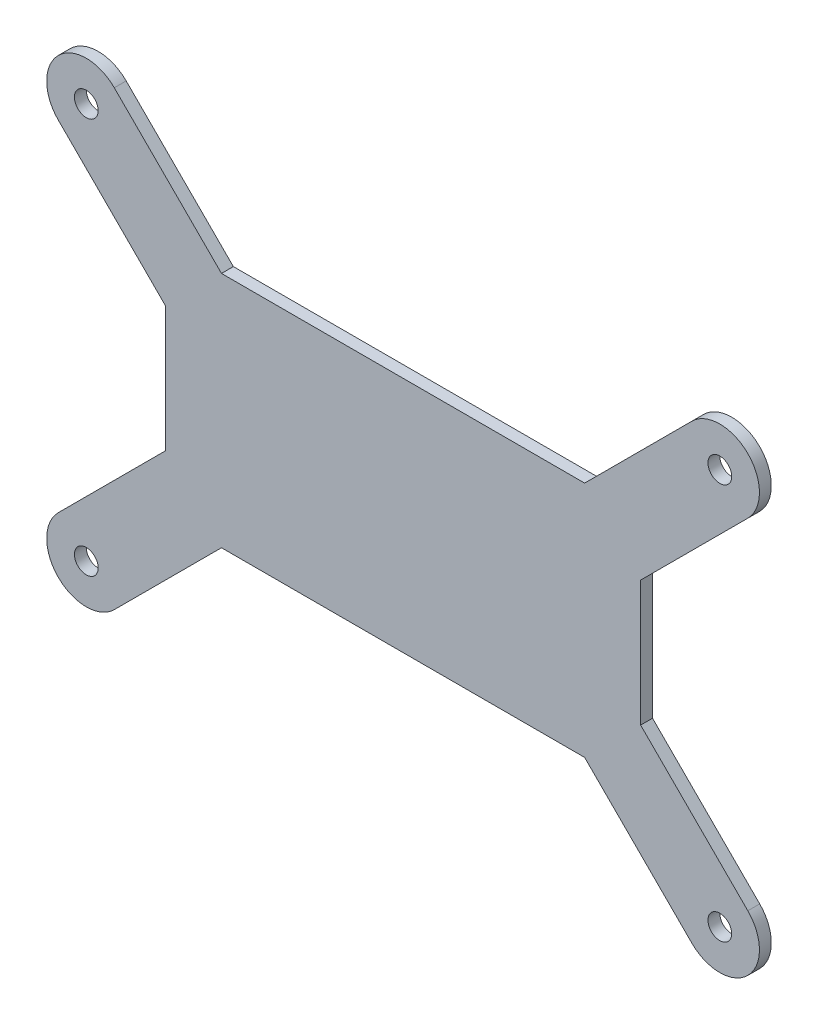
from build123d import *

# Parameters (mm, degrees)
SKETCH_1_R      = 1.5
EXTRUDE_1_DEPTH = 1.5


with BuildPart() as part:
    # 草图1 → 凸台-拉伸1 (new body)
    with BuildSketch(Plane.XY):
        with BuildLine():
            Line((-43.535533906, 21.464466094), (-30, 7.928932188))
            Line((-30, 7.928932188), (-30, -7.928932188))
            Line((-30, -7.928932188), (-43.535533906, -21.464466094))
            ThreePointArc((-43.535533906, -21.464466094), (-43.535533906, -28.535533906), (-36.464466094, -28.535533906))
            Line((-36.464466094, -28.535533906), (-22.928933621, -15.000001433))
            Line((-22.928933621, -15.000001433), (22.928933621, -15.000001433))
            Line((22.928933621, -15.000001433), (36.464466094, -28.535533906))
            ThreePointArc((36.464466094, -28.535533906), (43.535533906, -28.535533906), (43.535533906, -21.464466094))
            Line((43.535533906, -21.464466094), (30, -7.928932188))
            Line((30, -7.928932188), (30, 7.928932188))
            Line((30, 7.928932188), (43.535533906, 21.464466094))
            ThreePointArc((43.535533906, 21.464466094), (43.535533906, 28.535533906), (36.464466094, 28.535533906))
            Line((36.464466094, 28.535533906), (22.928933621, 15.000001433))
            Line((22.928933621, 15.000001433), (-22.928933621, 15.000001433))
            Line((-22.928933621, 15.000001433), (-36.464466094, 28.535533906))
            ThreePointArc((-36.464466094, 28.535533906), (-43.535533906, 28.535533906), (-43.535533906, 21.464466094))
        make_face()
        with Locations((-40, 25)):
            Circle(SKETCH_1_R, mode=Mode.SUBTRACT)
        with Locations((40, 25)):
            Circle(SKETCH_1_R, mode=Mode.SUBTRACT)
        with Locations((40, -25)):
            Circle(SKETCH_1_R, mode=Mode.SUBTRACT)
        with Locations((-40, -25)):
            Circle(SKETCH_1_R, mode=Mode.SUBTRACT)
    extrude(amount=EXTRUDE_1_DEPTH)


solid = part.part
